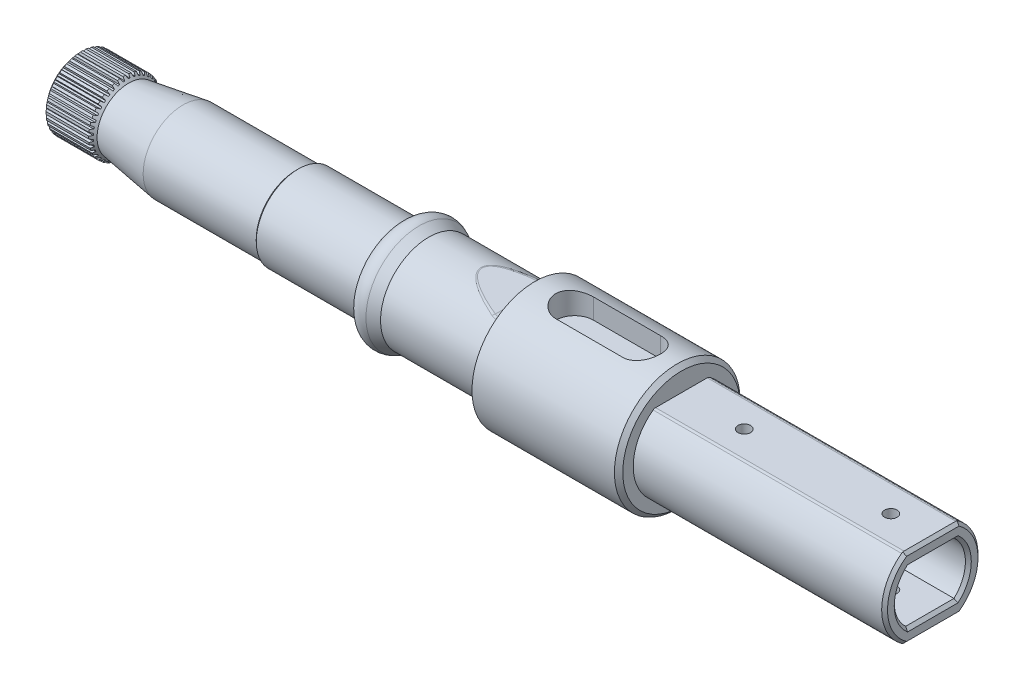
from build123d import *

# Parameters (mm, degrees)
ENL_V_MAT_EXTRU_1_DEPTH      = 206.936883553
ENL_V_MAT_EXTRU_3_DEPTH      = 97
CHANFREIN4_SIZE              = 0.7
CONG_2_R                     = 1
ESQUISSE5_W                  = 35
ESQUISSE5_H                  = 7
ENL_V_MAT_EXTRU_4_DEPTH      = 207.012742423
R_P_TITION_CIRCULAIRE1_COUNT = 2
CHANFREIN5_SIZE              = 1
ESQUISSE7_R                  = 1.5
ENL_V_MAT_EXTRU_5_DEPTH      = 207.012742443
ENL_V_MAT_EXTRU_6_DEPTH      = 12
R_P_TITION_CIRCULAIRE2_COUNT = 40
ESQUISSE9_R                  = 4.5
ENL_V_MAT_EXTRU_7_DEPTH      = 40


with BuildPart() as part:
    # Esquisse1 → Base-Révolution (revolve)
    with BuildSketch(Plane.XY, mode=Mode.PRIVATE) as base_r_volution_sk:
        with BuildLine():
            Line((0, 7.5), (0.80832938, 8.5))
            Line((0.80832938, 8.5), (11, 8.5))
            Line((11, 8.5), (12, 7.5))
            Line((12, 7.5), (25, 9.5))
            Line((25, 9.5), (52, 9.5))
            Line((52, 9.5), (52.5, 10))
            Line((52.5, 10), (76.535898385, 10))
            Line((76.535898385, 10), (77.401923789, 11.5))
            ThreePointArc((77.401923789, 11.5), (79.146977084, 12.876169659), (81.360155512, 12.673944088))
            Line((81.360155512, 12.673944088), (83.668024594, 11.5))
            Line((83.668024594, 11.5), (204, 11.5))
            Line((204, 11.5), (204, 0))
            Line((204, 0), (0, 0))
            Line((0, 0), (0, 7.5))
        make_face()
    revolve(base_r_volution_sk.sketch.rotate(Axis((-8, 0, 0), (1, 0, 0)), 90), axis=Axis((-8, 0, 0), (1, 0, 0)))

    # Esquisse2 → Enlèv. mat.-Extru.1 (cut, through all)
    with BuildSketch(Plane.XY.offset(12)):
        with BuildLine():
            Line((208, 9.5), (106.40749138, 9.5))
            ThreePointArc((106.40749138, 9.5), (106.002098171, 9.520595981), (105.600879698, 9.582171827))
            Line((105.600879698, 9.582171827), (89, 13))
            Line((89, 13), (208, 13))
            Line((208, 13), (208, 9.5))
        make_face()
        with BuildLine():
            Line((105.600879698, -9.582171827), (89, -13))
            Line((89, -13), (208, -13))
            Line((208, -13), (208, -9.5))
            Line((208, -9.5), (106.40749138, -9.5))
            ThreePointArc((106.40749138, -9.5), (106.002098171, -9.520595981), (105.600879698, -9.582171827))
        make_face()
    extrude(amount=-ENL_V_MAT_EXTRU_1_DEPTH, mode=Mode.SUBTRACT)

    # Esquisse4 → Enlèv. mat.-Extru.3 (cut)
    with BuildSketch(Plane(origin=(204, 0, 0), x_dir=(0, 0, -1), z_dir=(1, 0, 0))):
        with BuildLine():
            Line((-5.760859311, 6.25), (5.760859311, 6.25))
            ThreePointArc((5.760859311, 6.25), (8.5, 0), (5.760859311, -6.25))
            Line((5.760859311, -6.25), (-5.760859311, -6.25))
            ThreePointArc((-5.760859311, -6.25), (-8.5, 0), (-5.760859311, 6.25))
        make_face()
    extrude(amount=-ENL_V_MAT_EXTRU_3_DEPTH, mode=Mode.SUBTRACT)

    # Chanfrein4
    chanfrein4_edges = [part.edges().sort_by_distance(p)[0] for p in [
        (204, -5.372219372, 10.168050896),
        (204, 0, -11.5),
        (204, 5.372219372, 10.168050896),
        (204, 9.5, 0),
        (204, -9.5, 0),
        (204, -6.25, 0),
        (204, 0, -8.5),
        (204, 6.25, 0),
        (204, 0, 8.5),
    ]]
    chamfer(chanfrein4_edges, length=CHANFREIN4_SIZE)

    # Congé2
    cong_2_edges = [part.edges().sort_by_distance(p)[0] for p in [
        (96.285714301, -11.499999997, 0.000267464),
        (96.285714301, 11.499999997, 0.000267464),
    ]]
    fillet(cong_2_edges, radius=CONG_2_R)

    # Esquisse5 → Boss.-Révol.1 (revolve)
    with BuildSketch(Plane.XY, mode=Mode.PRIVATE) as boss_r_vol_1_sk:
        with Locations((126.5, 11.5)):
            Rectangle(ESQUISSE5_W, ESQUISSE5_H)
    revolve(boss_r_vol_1_sk.sketch.rotate(Axis((208.957139935, 0, 0), (-1, 0, 0)), 88.013097257), axis=Axis((208.957139935, 0, 0), (-1, 0, 0)))

    # Esquisse6 → Enlèv. mat.-Extru.4 (cut, through all)
    with BuildSketch(Plane(origin=(0, 9.5, 0), x_dir=(-1, 0, 0), z_dir=(0, 1, 0))):
        with BuildLine():
            Line((-134.5, -4.5), (-118.5, -4.5))
            ThreePointArc((-118.5, -4.5), (-114, 0), (-118.5, 4.5))
            Line((-118.5, 4.5), (-134.5, 4.5))
            ThreePointArc((-134.5, 4.5), (-139, 0), (-134.5, -4.5))
        make_face()
    enl_v_mat_extru_4 = extrude(amount=ENL_V_MAT_EXTRU_4_DEPTH, mode=Mode.SUBTRACT)

    # Répétition circulaire1: Enlèv. mat.-Extru.4 ×2 about axis
    r_p_tition_circulaire1_axis = Axis((0, 0, 0), (1, 0, 0))
    for i in range(1, R_P_TITION_CIRCULAIRE1_COUNT):
        add(enl_v_mat_extru_4.rotate(r_p_tition_circulaire1_axis, i * 360 / R_P_TITION_CIRCULAIRE1_COUNT), mode=Mode.SUBTRACT)

    # Chanfrein5
    chanfrein5_edges = [part.edges().sort_by_distance(p)[0] for p in [
        (144, -0.520065672, 14.990981679),
    ]]
    chamfer(chanfrein5_edges, length=CHANFREIN5_SIZE)

    # Esquisse7 → Enlèv. mat.-Extru.5 (cut, through all)
    with BuildSketch(Plane(origin=(0, 9.5, 0), x_dir=(-1, 0, 0), z_dir=(0, 1, 0))):
        with Locations((-194, 0)):
            Circle(ESQUISSE7_R)
        with Locations((-159, 0)):
            Circle(ESQUISSE7_R)
    extrude(amount=-ENL_V_MAT_EXTRU_5_DEPTH, mode=Mode.SUBTRACT)

    # Esquisse8 → Enlèv. mat.-Extru.6 (cut)
    with BuildSketch(Plane.ZY):
        Polygon((-0.204984936, 8.871804722), (-0.42545112, 7.945612011), (-0.822754454, 7.91434356), (-1.185394794, 8.794644793), align=None)
    enl_v_mat_extru_6 = extrude(amount=-ENL_V_MAT_EXTRU_6_DEPTH, mode=Mode.SUBTRACT)

    # Répétition circulaire2: Enlèv. mat.-Extru.6 ×40 about axis
    r_p_tition_circulaire2_axis = Axis((-8, 0, 0), (1, 0, 0))
    for i in range(1, R_P_TITION_CIRCULAIRE2_COUNT):
        add(enl_v_mat_extru_6.rotate(r_p_tition_circulaire2_axis, i * 360 / R_P_TITION_CIRCULAIRE2_COUNT), mode=Mode.SUBTRACT)

    # Esquisse9 → Enlèv. mat.-Extru.7 (cut)
    with BuildSketch(Plane.ZY):
        Circle(ESQUISSE9_R)
    extrude(amount=-ENL_V_MAT_EXTRU_7_DEPTH, mode=Mode.SUBTRACT)


solid = part.part
